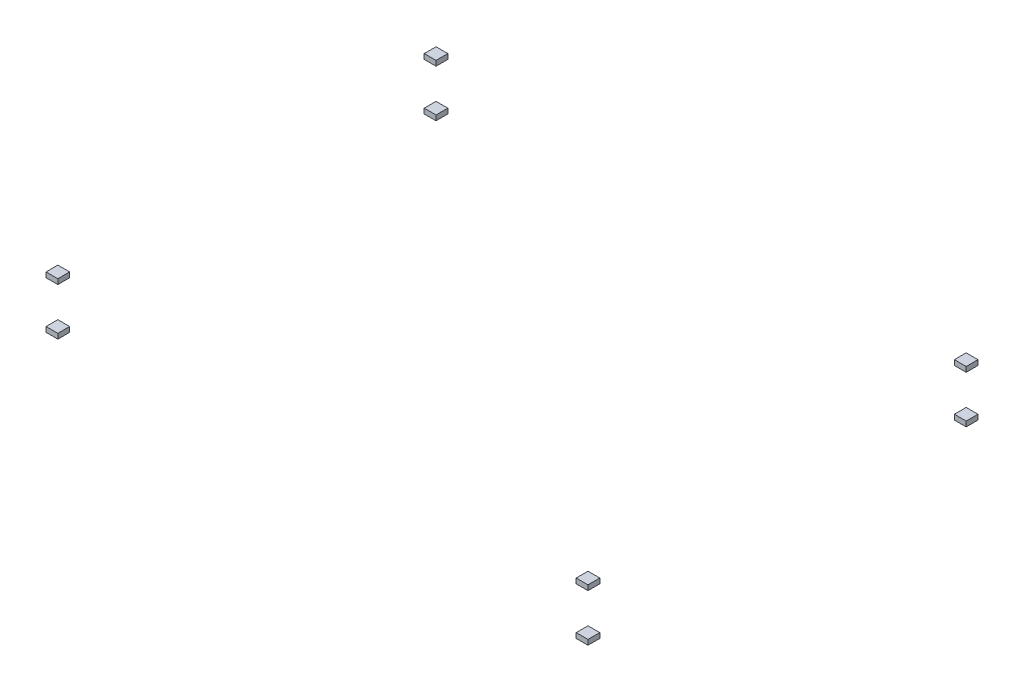
from build123d import *

# Parameters (mm, degrees)
BOSS_EXTRUDE1_START = -2310
SKETCH1_W           = 140
SKETCH1_H           = 60
BOSS_EXTRUDE1_DEPTH = 140
BOSS_EXTRUDE2_START = 2170
SKETCH2_W           = 140
SKETCH2_H           = 60
BOSS_EXTRUDE2_DEPTH = 140
BOSS_EXTRUDE3_START = -2310
SKETCH3_W           = 140
SKETCH3_H           = 60
BOSS_EXTRUDE3_DEPTH = 140
BOSS_EXTRUDE4_START = 2170
SKETCH4_W           = 140
SKETCH4_H           = 60
BOSS_EXTRUDE4_DEPTH = 140
BOSS_EXTRUDE5_START = -2310
SKETCH5_W           = 140
SKETCH5_H           = 60
BOSS_EXTRUDE5_DEPTH = 140
BOSS_EXTRUDE6_START = 2170
SKETCH6_W           = 140
SKETCH6_H           = 60
BOSS_EXTRUDE6_DEPTH = 140
BOSS_EXTRUDE7_START = -2310
SKETCH7_W           = 140
SKETCH7_H           = 60
BOSS_EXTRUDE7_DEPTH = 140
BOSS_EXTRUDE8_START = 2170
SKETCH8_W           = 140
SKETCH8_H           = 60
BOSS_EXTRUDE8_DEPTH = 140


with BuildPart() as part:
    # Sketch1 → Boss-Extrude1 (new body)
    with BuildSketch(Plane.XY.offset(BOSS_EXTRUDE1_START)):
        with Locations((-3140, -280)):
            Rectangle(SKETCH1_W, SKETCH1_H)
    extrude(amount=BOSS_EXTRUDE1_DEPTH)


with BuildPart() as body_2:
    # Sketch2 → Boss-Extrude2 (new body)
    with BuildSketch(Plane.XY.offset(BOSS_EXTRUDE2_START)):
        with Locations((-3140, -280)):
            Rectangle(SKETCH2_W, SKETCH2_H)
    extrude(amount=BOSS_EXTRUDE2_DEPTH)


with BuildPart() as body_3:
    # Sketch3 → Boss-Extrude3 (new body)
    with BuildSketch(Plane.XY.offset(BOSS_EXTRUDE3_START)):
        with Locations((-3140, 280)):
            Rectangle(SKETCH3_W, SKETCH3_H)
    extrude(amount=BOSS_EXTRUDE3_DEPTH)


with BuildPart() as body_4:
    # Sketch4 → Boss-Extrude4 (new body)
    with BuildSketch(Plane.XY.offset(BOSS_EXTRUDE4_START)):
        with Locations((-3140, 280)):
            Rectangle(SKETCH4_W, SKETCH4_H)
    extrude(amount=BOSS_EXTRUDE4_DEPTH)


with BuildPart() as body_5:
    # Sketch5 → Boss-Extrude5 (new body)
    with BuildSketch(Plane.XY.offset(BOSS_EXTRUDE5_START)):
        with Locations((3140, -280)):
            Rectangle(SKETCH5_W, SKETCH5_H)
    extrude(amount=BOSS_EXTRUDE5_DEPTH)


with BuildPart() as body_6:
    # Sketch6 → Boss-Extrude6 (new body)
    with BuildSketch(Plane.XY.offset(BOSS_EXTRUDE6_START)):
        with Locations((3140, -280)):
            Rectangle(SKETCH6_W, SKETCH6_H)
    extrude(amount=BOSS_EXTRUDE6_DEPTH)


with BuildPart() as body_7:
    # Sketch7 → Boss-Extrude7 (new body)
    with BuildSketch(Plane.XY.offset(BOSS_EXTRUDE7_START)):
        with Locations((3140, 280)):
            Rectangle(SKETCH7_W, SKETCH7_H)
    extrude(amount=BOSS_EXTRUDE7_DEPTH)


with BuildPart() as body_8:
    # Sketch8 → Boss-Extrude8 (new body)
    with BuildSketch(Plane.XY.offset(BOSS_EXTRUDE8_START)):
        with Locations((3140, 280)):
            Rectangle(SKETCH8_W, SKETCH8_H)
    extrude(amount=BOSS_EXTRUDE8_DEPTH)


solid = Compound([part.part, body_2.part, body_3.part, body_4.part, body_5.part, body_6.part, body_7.part, body_8.part])
